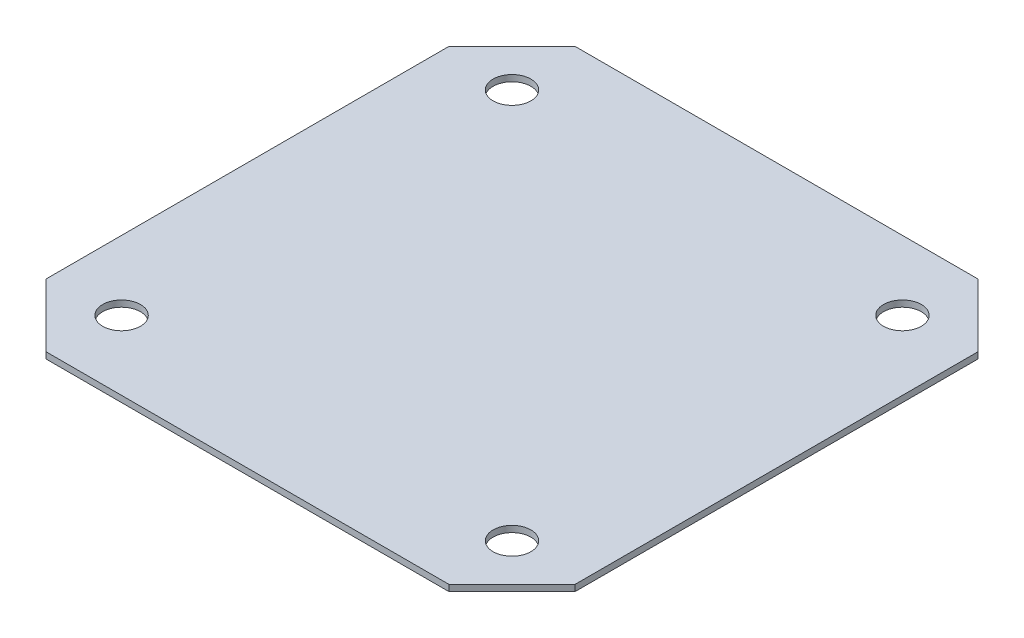
from build123d import *

# Parameters (mm, degrees)
CROQUIS1_W              = 42
CROQUIS1_H              = 42
SALIENTE_EXTRUIR1_DEPTH = 0.5
CROQUIS2_R              = 1.5
CORTAR_EXTRUIR1_DEPTH   = 0.5
CHAFL_N1_SIZE           = 5


with BuildPart() as part:
    # Croquis1 → Saliente-Extruir1 (new body)
    with BuildSketch(Plane(origin=(0, 0, 0), x_dir=(1, 0, 0), z_dir=(0, 1, 0))):
        with Locations((21, -21)):
            Rectangle(CROQUIS1_W, CROQUIS1_H)
    extrude(amount=SALIENTE_EXTRUIR1_DEPTH)

    # Croquis2 → Cortar-Extruir1 (cut)
    with BuildSketch(Plane(origin=(0, 0.5, 0), x_dir=(1, 0, 0), z_dir=(0, 1, 0))):
        with Locations(Location((5.5, -5.5, 0), (0, 0, 270))):
            Circle(CROQUIS2_R)
        with Locations(Location((36.5, -5.5, 0), (0, 0, 270))):
            Circle(CROQUIS2_R)
        with Locations(Location((36.5, -36.5, 0), (0, 0, 270))):
            Circle(CROQUIS2_R)
        with Locations(Location((5.5, -36.5, 0), (0, 0, 270))):
            Circle(CROQUIS2_R)
    extrude(amount=-CORTAR_EXTRUIR1_DEPTH, mode=Mode.SUBTRACT)

    # Chaflán1
    chafl_n1_edges = [part.edges().sort_by_distance(p)[0] for p in [
        (0, 0.25, 0),
        (42, 0.25, 0),
        (42, 0.25, 42),
        (0, 0.25, 42),
    ]]
    chamfer(chafl_n1_edges, length=CHAFL_N1_SIZE)


solid = part.part
